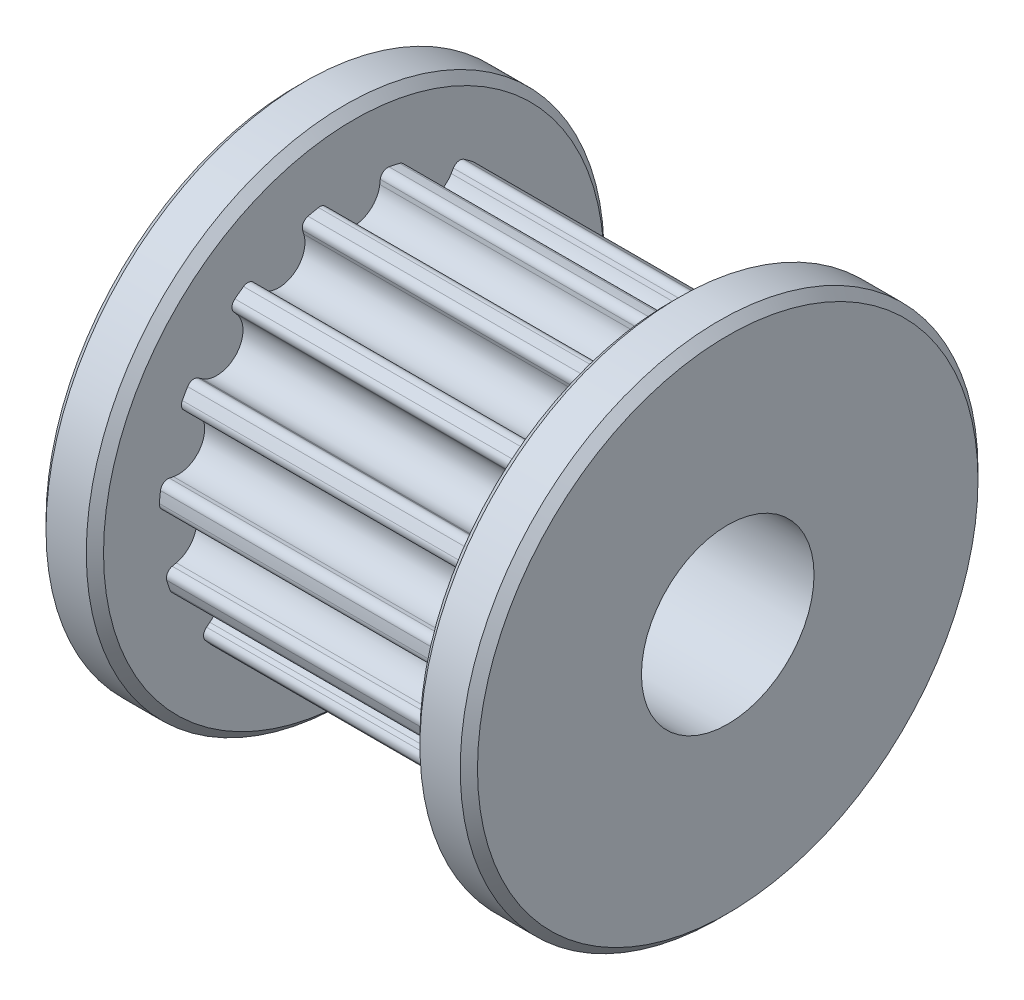
from build123d import *

# Parameters (mm, degrees)
CHAMFER_1_SIZE           = 1
SKETCH_4_W               = 2
SKETCH_4_H               = 1.440270842
CUT_EXTRUDE_1_DEPTH      = 23.179036994
CUT_EXTRUDE_2_REACH      = 24.179
PATTERN_CIRCULAR_3_COUNT = 15
SKETCH_7_R               = 3
CUT_EXTRUDE_3_DEPTH      = 23.173117564
EXTRUDE_START            = 2
SKETCH_9_R               = 9
SKETCH_9_R_2             = 3
EXTRUDE_1_DEPTH          = 2
SKETCH_10_R              = 9
SKETCH_10_R_2            = 3
EXTRUDE_2_DEPTH          = 2
CHAMFER_2_SIZE           = 0.3


with BuildPart() as part:
    # 草图1 → 旋转1 (revolve)
    with BuildSketch(Plane.XY, mode=Mode.PRIVATE) as revolve_1_sk:
        Polygon((0, 1.3558), (0, 6.779), (11, 6.779), (11, 2.7116), (20, 2.7116), (20, 1.3558), align=None)
    revolve(revolve_1_sk.sketch.rotate(Axis((0, 0, 0), (1, 0, 0)), 90), axis=Axis((0, 0, 0), (1, 0, 0)))

    # 倒角1
    chamfer_1_edges = [part.edges().sort_by_distance(p)[0] for p in [
        (20, 0, -1.3558),
        (0, 0, -1.3558),
    ]]
    chamfer(chamfer_1_edges, length=CHAMFER_1_SIZE)

    # 草图4 → 切除-拉伸1 (cut, through all)
    with BuildSketch(Plane.ZY):
        with Locations((0, 1.635664579)):
            Rectangle(SKETCH_4_W, SKETCH_4_H)
    extrude(amount=-CUT_EXTRUDE_1_DEPTH, mode=Mode.SUBTRACT)

    # 草图6 → 切除-拉伸2 (cut, up to next)
    with BuildSketch(Plane(origin=(0, 0, 0), x_dir=(0, 0, -1), z_dir=(1, 0, 0)), mode=Mode.PRIVATE) as cut_extrude_2_sk1:
        with BuildLine():
            Line((0.921029279, 6.443168288), (0.903216998, 6.298098898))
            ThreePointArc((0.903216998, 6.298098898), (0, 5.499), (-0.903216998, 6.298098898))
            Line((-0.903216998, 6.298098898), (-0.921029279, 6.443168288))
            ThreePointArc((-0.921029279, 6.443168288), (-1.025205225, 6.62105106), (-1.226117469, 6.667194084))
            ThreePointArc((-1.226117469, 6.667194084), (-1.353747907, 6.642454938), (-1.480880455, 6.615272789))
            Line((-1.480880455, 6.615272789), (-1.677528444, 8.216842132))
            ThreePointArc((-1.677528444, 8.216842132), (0, 8.386333901), (1.677528444, 8.216842132))
            Line((1.677528444, 8.216842132), (1.480880455, 6.615272789))
            ThreePointArc((1.480880455, 6.615272789), (1.353747907, 6.642454938), (1.226117469, 6.667194084))
            ThreePointArc((1.226117469, 6.667194084), (1.025205225, 6.62105106), (0.921029279, 6.443168288))
        make_face()
    cut_extrude_2_tool1 = extrude(cut_extrude_2_sk1.sketch, amount=CUT_EXTRUDE_2_REACH, mode=Mode.PRIVATE) & part.part
    cut_extrude_2 = cut_extrude_2_tool1.solids().sort_by_distance((0, 7.172733, 0))[0]
    add(cut_extrude_2, mode=Mode.SUBTRACT)

    # 阵列(圆周)3: 切除-拉伸2 ×15 about axis
    pattern_circular_3_axis = Axis((0, 0, 0), (1, 0, 0))
    for i in range(1, PATTERN_CIRCULAR_3_COUNT):
        add(cut_extrude_2.rotate(pattern_circular_3_axis, i * 360 / PATTERN_CIRCULAR_3_COUNT), mode=Mode.SUBTRACT)

    # 草图7 → 切除-拉伸3 (cut, through all)
    with BuildSketch(Plane.ZY):
        Circle(SKETCH_7_R)
    extrude(amount=-CUT_EXTRUDE_3_DEPTH, mode=Mode.SUBTRACT)

    # 草图9 → 凸台-拉伸1 (add)
    with BuildSketch(Plane.ZY.offset(EXTRUDE_START)):
        Circle(SKETCH_9_R)
        Circle(SKETCH_9_R_2, mode=Mode.SUBTRACT)
    extrude(amount=-EXTRUDE_1_DEPTH)

    # 草图10 → 凸台-拉伸2 (add)
    with BuildSketch(Plane(origin=(11, 0, 0), x_dir=(0, 0, -1), z_dir=(1, 0, 0))):
        with Locations(Location((0, 0, 0), (0, 0, 180))):
            Circle(SKETCH_10_R)
        with Locations(Location((0, 0, 0), (0, 0, 180))):
            Circle(SKETCH_10_R_2, mode=Mode.SUBTRACT)
    extrude(amount=EXTRUDE_2_DEPTH)

    # 倒角2
    chamfer_2_edges = [part.edges().sort_by_distance(p)[0] for p in [
        (-2, 0, -9),
        (0, 0, -9),
        (13, 0, -9),
        (11, 0, -9),
    ]]
    chamfer(chamfer_2_edges, length=CHAMFER_2_SIZE)


solid = part.part
